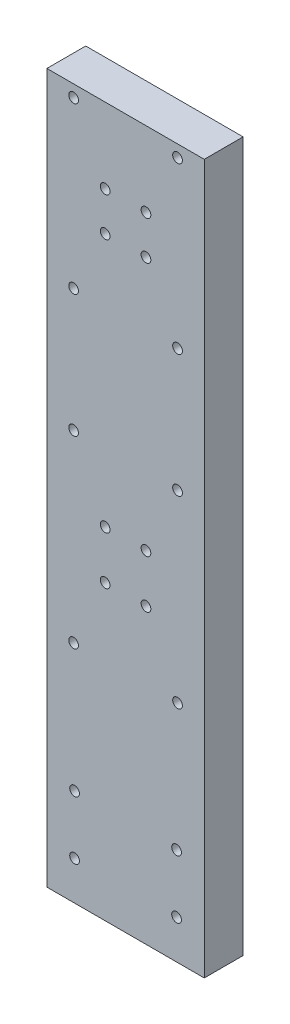
from build123d import *

# Parameters (mm, degrees)
SKETCH1_W           = 16.2
SKETCH1_H           = 72.99
SKETCH1_R           = 0.5
BOSS_EXTRUDE1_DEPTH = 4


with BuildPart() as part:
    # Sketch1 → Boss-Extrude1 (new body)
    with BuildSketch(Plane.XY):
        with Locations((8.1, 36.495)):
            Rectangle(SKETCH1_W, SKETCH1_H)
        with Locations((6, 30.15)):
            Circle(SKETCH1_R, mode=Mode.SUBTRACT)
        with Locations((10.2, 30.15)):
            Circle(SKETCH1_R, mode=Mode.SUBTRACT)
        with Locations((10.2, 35.11)):
            Circle(SKETCH1_R, mode=Mode.SUBTRACT)
        with Locations((10.2, 61.26)):
            Circle(SKETCH1_R, mode=Mode.SUBTRACT)
        with Locations((13.45, 54.76)):
            Circle(SKETCH1_R, mode=Mode.SUBTRACT)
        with Locations((6, 61.26)):
            Circle(SKETCH1_R, mode=Mode.SUBTRACT)
        with Locations((6, 35.11)):
            Circle(SKETCH1_R, mode=Mode.SUBTRACT)
        with Locations((2.75, 42.11)):
            Circle(SKETCH1_R, mode=Mode.SUBTRACT)
        with Locations((2.85, 10)):
            Circle(SKETCH1_R, mode=Mode.SUBTRACT)
        with Locations(Location((13.35, 10, 0), (0, 0, 180))):
            Circle(SKETCH1_R, mode=Mode.SUBTRACT)
        with Locations(Location((13.35, 4, 0), (0, 0, 180))):
            Circle(SKETCH1_R, mode=Mode.SUBTRACT)
        with Locations((2.85, 4)):
            Circle(SKETCH1_R, mode=Mode.SUBTRACT)
        with Locations((13.45, 42.11)):
            Circle(SKETCH1_R, mode=Mode.SUBTRACT)
        with Locations((2.75, 54.76)):
            Circle(SKETCH1_R, mode=Mode.SUBTRACT)
        with Locations((13.45, 23.15)):
            Circle(SKETCH1_R, mode=Mode.SUBTRACT)
        with Locations((2.75, 23.15)):
            Circle(SKETCH1_R, mode=Mode.SUBTRACT)
        with Locations(Location((10.2, 65.26, 0), (0, 0, 180))):
            Circle(SKETCH1_R, mode=Mode.SUBTRACT)
        with Locations(Location((13.45, 71.76, 0), (0, 0, 180))):
            Circle(SKETCH1_R, mode=Mode.SUBTRACT)
        with Locations(Location((6, 65.26, 0), (0, 0, 180))):
            Circle(SKETCH1_R, mode=Mode.SUBTRACT)
        with Locations(Location((2.75, 71.76, 0), (0, 0, 180))):
            Circle(SKETCH1_R, mode=Mode.SUBTRACT)
    extrude(amount=BOSS_EXTRUDE1_DEPTH)


solid = part.part
